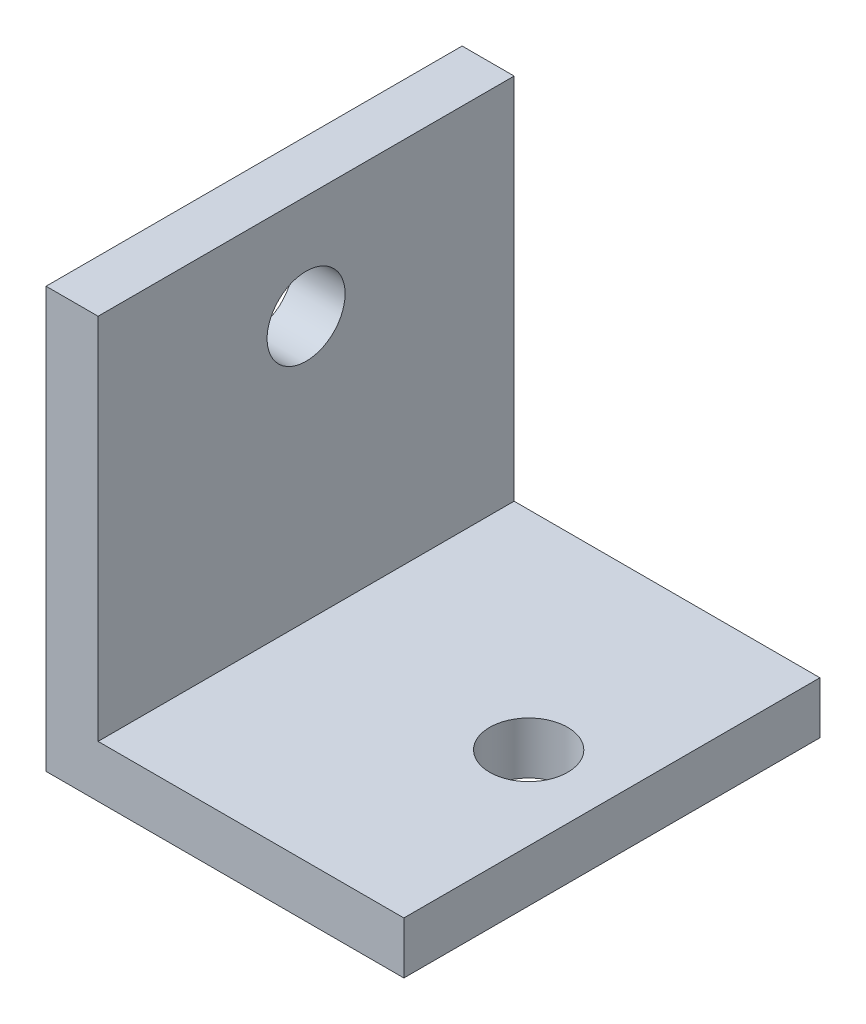
from build123d import *

# Parameters (mm, degrees)
BOSS_EXTRUDE1_DEPTH = 25.4
SKETCH2_R           = 2.38125
CUT_EXTRUDE1_DEPTH  = 41.642579606
SKETCH3_R           = 2.38125
CUT_EXTRUDE2_DEPTH  = 41.343844351


with BuildPart() as part:
    # Sketch1 → Boss-Extrude1 (new body)
    with BuildSketch(Plane.XY):
        Polygon((0, 0), (0, 25.654), (3.175, 25.654), (3.175, 3.175), (21.844, 3.175), (21.844, 0), align=None)
    extrude(amount=BOSS_EXTRUDE1_DEPTH)

    # Sketch2 → Cut-Extrude1 (cut, through all)
    with BuildSketch(Plane(origin=(3.175, 0, 0), x_dir=(0, 0, -1), z_dir=(1, 0, 0))):
        with Locations((-12.7, 19.304)):
            Circle(SKETCH2_R)
    extrude(amount=-CUT_EXTRUDE1_DEPTH, mode=Mode.SUBTRACT)

    # Sketch3 → Cut-Extrude2 (cut, through all)
    with BuildSketch(Plane(origin=(0, 3.175, 0), x_dir=(1, 0, 0), z_dir=(0, 1, 0))):
        with Locations(Location((16.764, -12.7, 0), (0, 0, 270))):
            Circle(SKETCH3_R)
    extrude(amount=-CUT_EXTRUDE2_DEPTH, mode=Mode.SUBTRACT)


solid = part.part
